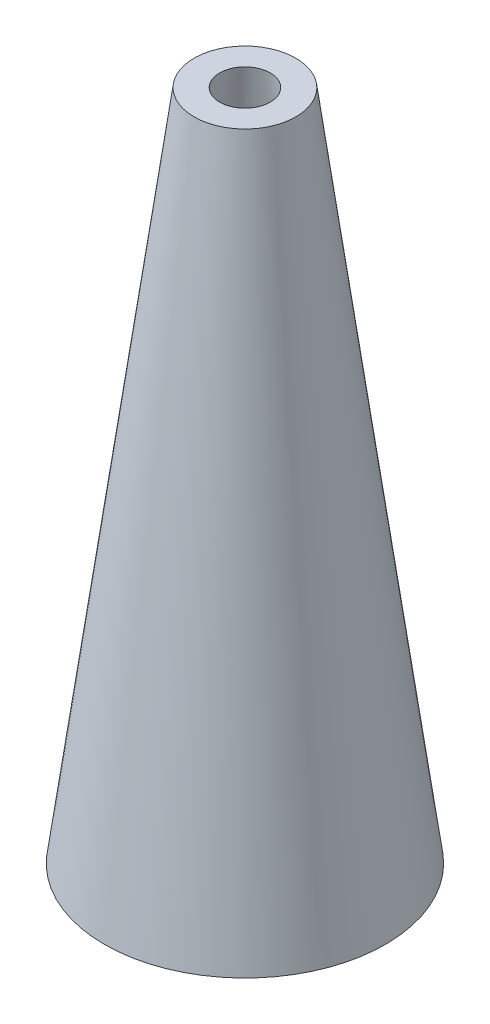
from build123d import *

# Parameters (mm, degrees)
SKETCH1_R           = 5.5
BOSS_EXTRUDE1_DEPTH = 26.3
BOSS_EXTRUDE1_TAPER = 7.6
SKETCH2_R           = 4.5
CUT_EXTRUDE1_DEPTH  = 26.3
CUT_EXTRUDE1_DRAFT  = -7.6


with BuildPart() as part:
    # Sketch1 → Boss-Extrude1 (new body)
    with BuildSketch(Plane(origin=(0, 0, 0), x_dir=(1, 0, 0), z_dir=(0, 1, 0))):
        Circle(SKETCH1_R)
    extrude(amount=BOSS_EXTRUDE1_DEPTH, taper=BOSS_EXTRUDE1_TAPER)


with BuildPart() as cut_extrude1_tool:
    # Sketch2 → Cut-Extrude1 (with draft: the straight prism first)
    with BuildSketch(Plane.XZ):
        Circle(SKETCH2_R)
    extrude(amount=-CUT_EXTRUDE1_DEPTH)
    # Cut-Extrude1: the draft: its side faces are tilted about the plane it starts from
    cut_extrude1_sides = [cut_extrude1_tool.faces().sort_by_distance(p)[0] for p in [
        (-4.5, 13.15, 0),
    ]]
    draft(cut_extrude1_sides, Plane.XZ, CUT_EXTRUDE1_DRAFT)


with BuildPart() as part_1:
    add(part.part)

    # Cut-Extrude1: cut by cut_extrude1_tool
    add(cut_extrude1_tool.part, mode=Mode.SUBTRACT)


solid = part_1.part
